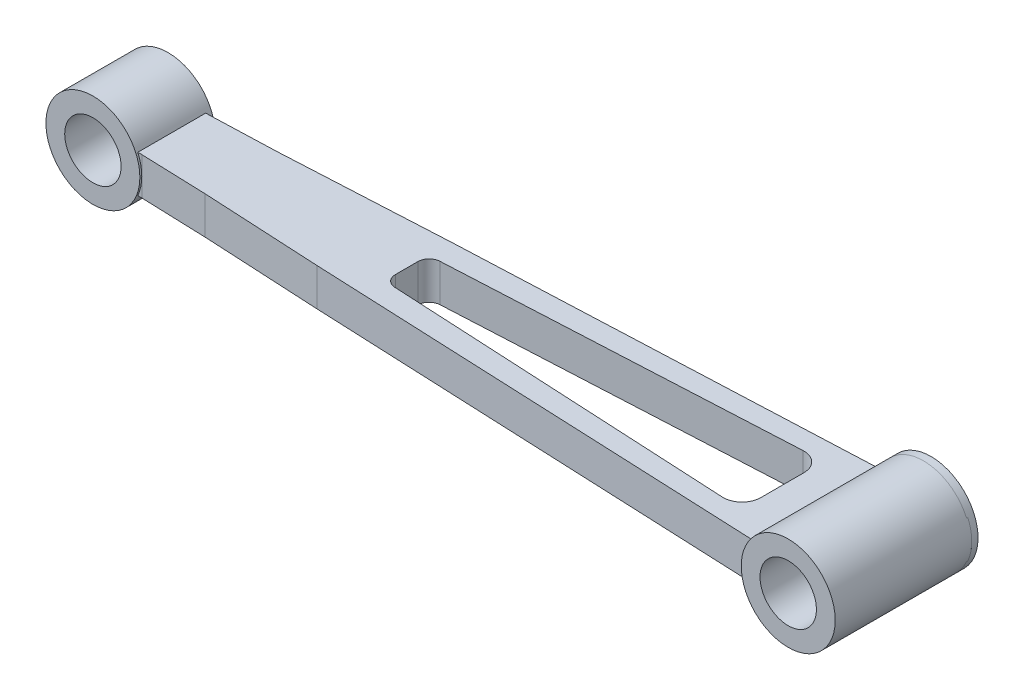
from build123d import *
from build123d.topology import SkipClean

# Parameters (mm, degrees)
SKETCH1_W            = 12.5
SKETCH1_H            = 34.321806876
BOSS_EXTRUDE6_DEPTH  = 10
SKETCH12_R           = 12.5
BOSS_EXTRUDE7_DEPTH  = 19
SKETCH13_W           = 1.043560763
SKETCH13_H           = 10
CUT_EXTRUDE7_DEPTH   = 28
SKETCH14_R           = 12.5
BOSS_EXTRUDE8_DEPTH  = 19
BOSS_EXTRUDE9_START  = 0.5
SKETCH15_R           = 12.5
BOSS_EXTRUDE9_DEPTH  = 0.5
SKETCH16_R           = 12.5
BOSS_EXTRUDE10_DEPTH = 0.5
SKETCH17_R           = 7.5
CUT_EXTRUDE8_DEPTH   = 222.975172602
SKETCH18_R           = 12.5
BOSS_EXTRUDE12_DEPTH = 34
BOSS_EXTRUDE13_START = 2
SKETCH19_R           = 12.5
BOSS_EXTRUDE13_DEPTH = 2
CUT_EXTRUDE9_DEPTH   = 224.231084876
CUT_EXTRUDE10_DEPTH  = 224.231084876
SKETCH22_R           = 12.499858014
BOSS_EXTRUDE14_DEPTH = 2
SKETCH23_R           = 7.5
CUT_EXTRUDE11_DEPTH  = 224.510276274


with BuildPart() as part:
    # Sketch1 → Boss-Extrude6 (new body)
    # profile 1 of 4: a face of its own
    with BuildSketch(Plane(origin=(0, 0, 0), x_dir=(1, 0, 0), z_dir=(0, 1, 0))):
        Polygon((207.06, 17.17985688), (207.06, -17.141949996), (73.89, -11.327622229), (42.5, -9.682542038), (42.5, 9.611113466), (86.39, 11.911290899), align=None)
        with BuildLine():
            ThreePointArc((186.39, 5.699516226), (184.834119176, 9.324160084), (181.134782759, 10.692998393))
            Line((181.134782759, 10.692998393), (89.236869656, 5.996089301))
            ThreePointArc((89.236869656, 5.996089301), (87.215213685, 5.066471506), (86.39, 3))
            Line((86.39, 3), (86.39, 0))
            Line((86.39, 0), (86.39, -3))
            ThreePointArc((86.39, -3), (87.214497256, -5.065717263), (89.234791873, -5.995982383))
            Line((89.234791873, -5.995982383), (181.131319788, -10.756720653))
            ThreePointArc((181.131319788, -10.756720653), (184.832862104, -9.389254589), (186.39, -5.763416682))
            Line((186.39, -5.763416682), (186.39, 5.699516226))
        make_face(mode=Mode.SUBTRACT)
    # profile 2 of 4: a face of its own
    with BuildSketch(Plane(origin=(0, 0, 0), x_dir=(1, 0, 0), z_dir=(0, 1, 0))):
        Polygon((25, 9), (42.5, 9.611113466), (42.5, -9.682542038), (25, -9.071428571), align=None)
    # profile 3 of 4: a face of its own
    with BuildSketch(Plane(origin=(0, 0, 0), x_dir=(1, 0, 0), z_dir=(0, 1, 0))):
        Polygon((0, -9), (0, -9.071428571), (25, -9.071428571), (25, 9), (0, 9), (0, 0), align=None)
    # profile 4 of 4: a face of its own
    with BuildSketch(Plane(origin=(0, 0, 0), x_dir=(1, 0, 0), z_dir=(0, 1, 0))):
        with Locations((213.31, 0.018953442)):
            Rectangle(SKETCH1_W, SKETCH1_H)
    extrude(amount=BOSS_EXTRUDE6_DEPTH)

    # Sketch12 → Boss-Extrude7 (add)
    with BuildSketch(Plane.XY.offset(9.071428571)):
        with Locations((12.5, 5)):
            Circle(SKETCH12_R)
    extrude(amount=-BOSS_EXTRUDE7_DEPTH)

    # Sketch13 → Cut-Extrude7 (cut)
    with BuildSketch(Plane.XY.offset(9.071428571)):
        with Locations((0.521780382, 5)):
            Rectangle(SKETCH13_W, SKETCH13_H)
    extrude(amount=-CUT_EXTRUDE7_DEPTH, mode=Mode.SUBTRACT)

    # Sketch14 → Boss-Extrude8 (add)
    with BuildSketch(Plane.XY.offset(9.071428571)):
        with Locations((12.5, 5)):
            Circle(SKETCH14_R)
    extrude(amount=-BOSS_EXTRUDE8_DEPTH)

    # Sketch15 → Boss-Extrude9 (add)
    with BuildSketch(Plane.XY.offset(9.071428571).offset(BOSS_EXTRUDE9_START)):
        with Locations((12.5, 5)):
            Circle(SKETCH15_R)
    extrude(amount=-BOSS_EXTRUDE9_DEPTH)

    # Sketch16 → Boss-Extrude10 (add)
    with SkipClean():  # the faces are left unmerged after this step: merging them gives an invalid solid
        with BuildSketch(Plane(origin=(0, 0, -9.928571429), x_dir=(-1, 0, 0), z_dir=(0, 0, -1))):
            with Locations(Location((-12.5, 5, 0), (0, 0, 180))):
                Circle(SKETCH16_R)
        extrude(amount=BOSS_EXTRUDE10_DEPTH)

    # Sketch17 → Cut-Extrude8 (cut, through all)
    with SkipClean():  # the faces are left unmerged after this step: merging them gives an invalid solid
        with BuildSketch(Plane(origin=(0, 0, -10.428571429), x_dir=(-1, 0, 0), z_dir=(0, 0, -1))):
            with Locations((-12.5, 5)):
                Circle(SKETCH17_R)
        extrude(amount=-CUT_EXTRUDE8_DEPTH, mode=Mode.SUBTRACT)

    # Sketch18 → Boss-Extrude12 (add)
    with SkipClean():  # the faces are left unmerged after this step: merging them gives an invalid solid
        with BuildSketch(Plane.XY.offset(17.141949996)):
            with Locations((207.06, 5)):
                Circle(SKETCH18_R)
        extrude(amount=-BOSS_EXTRUDE12_DEPTH)

    # Sketch19 → Boss-Extrude13 (add)
    with SkipClean():  # the faces are left unmerged after this step: merging them gives an invalid solid
        with BuildSketch(Plane.XY.offset(17.141949996).offset(BOSS_EXTRUDE13_START)):
            with Locations((207.06, 5)):
                Circle(SKETCH19_R)
        extrude(amount=-BOSS_EXTRUDE13_DEPTH)

    # Sketch20 → Cut-Extrude9 (cut, through all)
    with SkipClean():  # the faces are left unmerged after this step: merging them gives an invalid solid
        with BuildSketch(Plane.XY.offset(19.141949996)):
            with BuildLine():
                Line((218.516439237, 10), (219.56, 10))
                Line((219.56, 10), (219.56, 5))
                ThreePointArc((219.56, 5), (219.296328912, 7.553870546), (218.516439237, 10))
            make_face()
        extrude(amount=-CUT_EXTRUDE9_DEPTH, mode=Mode.SUBTRACT)

    # Sketch21 → Cut-Extrude10 (cut, through all)
    with SkipClean():  # the faces are left unmerged after this step: merging them gives an invalid solid
        with BuildSketch(Plane.XY.offset(19.141949996)):
            with BuildLine():
                Line((218.516439237, 0), (219.56, 0))
                Line((219.56, 0), (219.56, 5))
                ThreePointArc((219.56, 5), (219.296328912, 2.446129454), (218.516439237, 0))
            make_face()
        extrude(amount=-CUT_EXTRUDE10_DEPTH, mode=Mode.SUBTRACT)

    # Sketch22 → Boss-Extrude14 (add)
    with SkipClean():  # the faces are left unmerged after this step: merging them gives an invalid solid
        with BuildSketch(Plane(origin=(0, 0, -16.858050004), x_dir=(-1, 0, 0), z_dir=(0, 0, -1))):
            with Locations(Location((-207.06, 5, 0), (0, 0, 203.578462521))):
                Circle(SKETCH22_R)
        extrude(amount=BOSS_EXTRUDE14_DEPTH)

    # Sketch23 → Cut-Extrude11 (cut, through all)
    with SkipClean():  # the faces are left unmerged after this step: merging them gives an invalid solid
        with BuildSketch(Plane(origin=(0, 0, -18.858050004), x_dir=(-1, 0, 0), z_dir=(0, 0, -1))):
            with Locations((-207.06, 5)):
                Circle(SKETCH23_R)
        extrude(amount=-CUT_EXTRUDE11_DEPTH, mode=Mode.SUBTRACT)


solid = part.part
